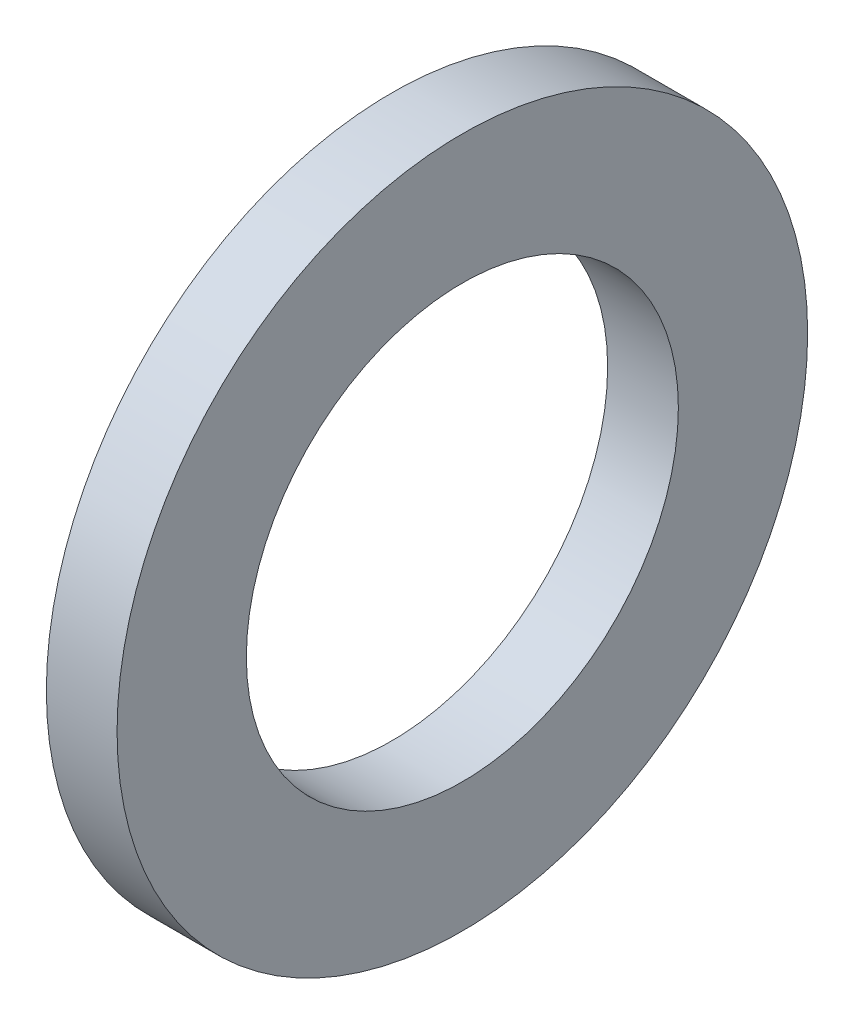
from build123d import *

# Parameters (mm, degrees)
SKETCH1_R           = 7.9375
SKETCH1_R_2         = 4.9657
BOSS_EXTRUDE1_DEPTH = 0.8128


with BuildPart() as part:
    # Sketch1 → Boss-Extrude1 (new, symmetric)
    with BuildSketch(Plane(origin=(0, 0, 0), x_dir=(0, 0, -1), z_dir=(1, 0, 0))):
        Circle(SKETCH1_R)
        Circle(SKETCH1_R_2, mode=Mode.SUBTRACT)
    extrude(amount=BOSS_EXTRUDE1_DEPTH, both=True)


solid = part.part
